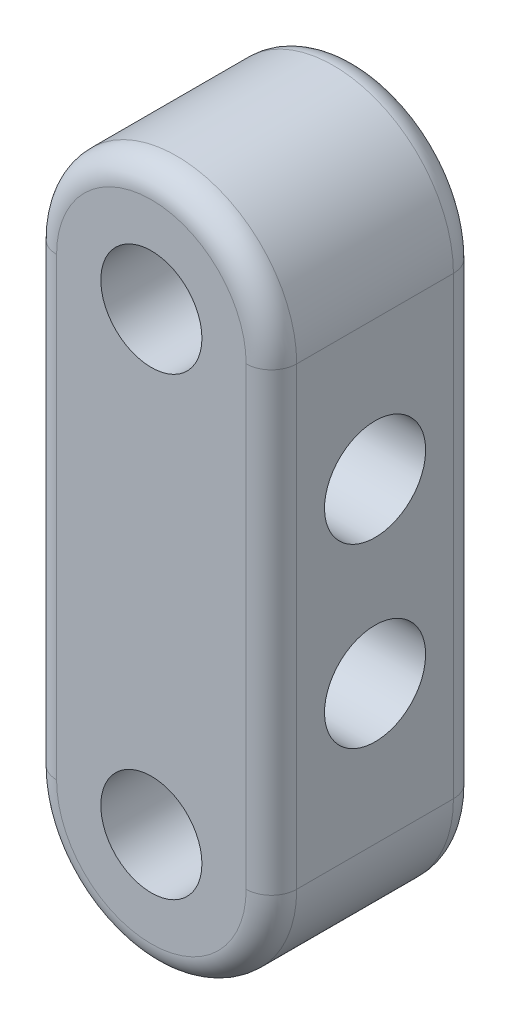
from build123d import *

# Parameters (mm, degrees)
BASE_EXTRUSION_DEPTH    = 8.2
ESQUISSE2_R             = 2
ENL_V_MAT_EXTRU_1_DEPTH = 26.981772457
CONG_1_R                = 1
CONG_2_R                = 1
ESQUISSE3_R             = 2
ENL_V_MAT_EXTRU_2_DEPTH = 26.981772457


with BuildPart() as part:
    # Esquisse1 → Base-Extrusion (new body)
    with BuildSketch(Plane.XY):
        with BuildLine():
            Line((0, 0), (0, 18))
            ThreePointArc((0, 18), (4.75, 22.75), (9.5, 18))
            Line((9.5, 18), (9.5, 0))
            ThreePointArc((9.5, 0), (4.75, -4.75), (0, 0))
        make_face()
    extrude(amount=BASE_EXTRUSION_DEPTH)

    # Esquisse2 → Enlèv. mat.-Extru.1 (cut, through all)
    with BuildSketch(Plane.XY.offset(8.2)):
        with Locations((4.75, 18)):
            Circle(ESQUISSE2_R)
        with Locations((4.75, 0)):
            Circle(ESQUISSE2_R)
    extrude(amount=-ENL_V_MAT_EXTRU_1_DEPTH, mode=Mode.SUBTRACT)

    # Congé1
    cong_1_edges = [part.edges().sort_by_distance(p)[0] for p in [
        (4.75, 22.75, 8.2),
        (0, 9, 8.2),
        (4.75, -4.75, 8.2),
        (9.5, 9, 8.2),
    ]]
    fillet(cong_1_edges, radius=CONG_1_R)

    # Congé2
    cong_2_edges = [part.edges().sort_by_distance(p)[0] for p in [
        (0, 9, 0),
        (4.75, 22.75, 0),
        (9.5, 9, 0),
        (4.75, -4.75, 0),
    ]]
    fillet(cong_2_edges, radius=CONG_2_R)

    # Esquisse3 → Enlèv. mat.-Extru.2 (cut, through all)
    with BuildSketch(Plane(origin=(9.5, 0, 0), x_dir=(0, 0, -1), z_dir=(1, 0, 0))):
        with Locations(Location((-4.1, 12.5, 0), (0, 0, 90))):
            Circle(ESQUISSE3_R)
        with Locations(Location((-4.1, 5.5, 0), (0, 0, 90))):
            Circle(ESQUISSE3_R)
    extrude(amount=-ENL_V_MAT_EXTRU_2_DEPTH, mode=Mode.SUBTRACT)


solid = part.part
